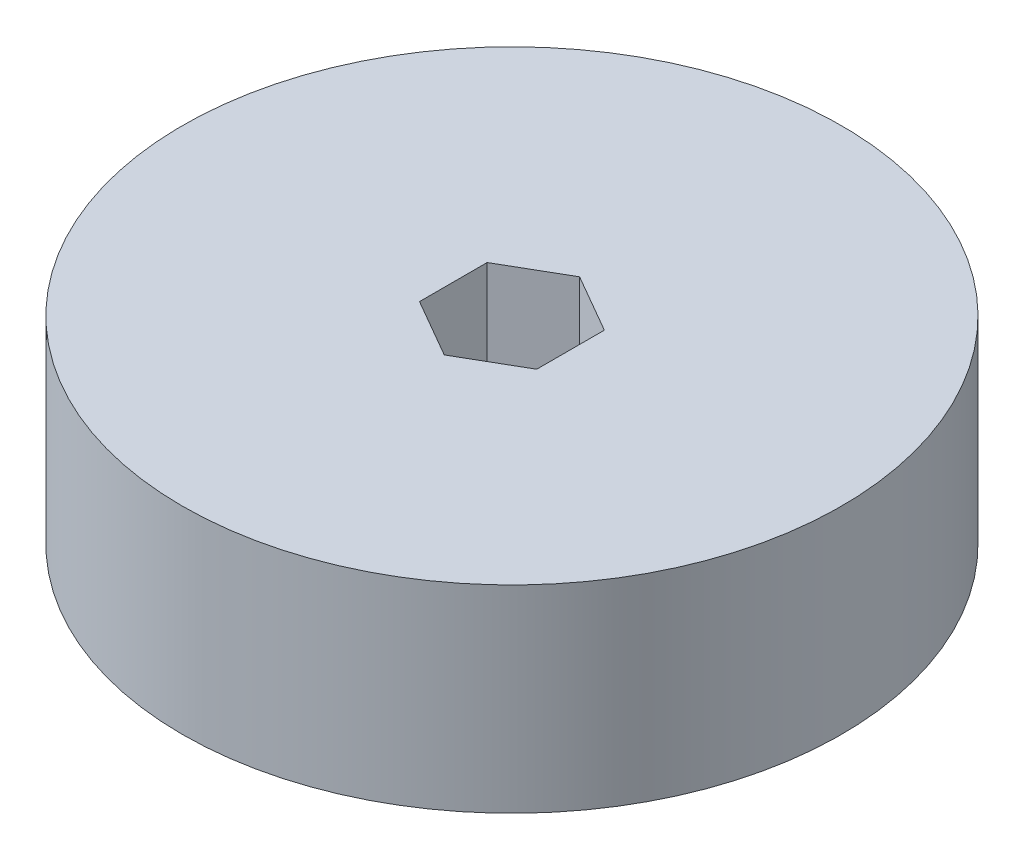
from build123d import *

# Parameters (mm, degrees)
SKETCH1_R           = 25
BOSS_EXTRUDE1_DEPTH = 15
CUT_EXTRUDE2_REACH  = 40.406
CUT_EXTRUDE3_DEPTH  = 5


with BuildPart() as part:
    # Sketch1 → Boss-Extrude1 (new body)
    with BuildSketch(Plane(origin=(0, 0, 0), x_dir=(1, 0, 0), z_dir=(0, 1, 0))):
        with Locations(Location((0, 0, 0), (0, 0, 270))):
            Circle(SKETCH1_R)
    extrude(amount=BOSS_EXTRUDE1_DEPTH)

    # Sketch7 → Cut-Extrude2 (cut, up to next)
    with BuildSketch(Plane(origin=(0, 15, 0), x_dir=(1, 0, 0), z_dir=(0, 1, 0)), mode=Mode.PRIVATE) as cut_extrude2_sk1:
        Polygon((0, 5.132643893), (-4.445, 2.566321947), (-4.445, -2.566321947), (0, -5.132643893), (4.445, -2.566321947), (4.445, 2.566321947), align=None)
    cut_extrude2_tool1 = extrude(cut_extrude2_sk1.sketch, amount=-CUT_EXTRUDE2_REACH, mode=Mode.PRIVATE) & part.part
    add(cut_extrude2_tool1.solids().sort_by_distance((0, 15, 0))[0], mode=Mode.SUBTRACT)

    # Sketch8 → Cut-Extrude3 (cut)
    with BuildSketch(Plane.XZ):
        with BuildLine():
            ThreePointArc((2.867832451, 6.276606431), (5.55485913, 5.311303559), (8.103473198, 4.024257195))
            ThreePointArc((8.103473198, 4.024257195), (12.790122891, 3.37163327), (17.445502266, 2.524257195))
            ThreePointArc((17.445502266, 2.524257195), (19.894779582, 1.820498395), (21, -0.475742805))
            ThreePointArc((21, -0.475742805), (19.894779582, -2.771984005), (17.445502266, -3.475742805))
            ThreePointArc((17.445502266, -3.475742805), (12.790122891, -4.32311888), (8.103473198, -4.975742805))
            ThreePointArc((8.103473198, -4.975742805), (5.55485913, -6.262789168), (2.867832451, -7.22809204))
            ThreePointArc((2.867832451, -7.22809204), (0, -7.852228414), (-2.867832451, -7.22809204))
            ThreePointArc((-2.867832451, -7.22809204), (-5.55485913, -6.262789168), (-8.103473198, -4.975742805))
            ThreePointArc((-8.103473198, -4.975742805), (-12.790122891, -4.32311888), (-17.445502266, -3.475742805))
            ThreePointArc((-17.445502266, -3.475742805), (-19.894779582, -2.771984005), (-21, -0.475742805))
            ThreePointArc((-21, -0.475742805), (-19.894779582, 1.820498395), (-17.445502266, 2.524257195))
            ThreePointArc((-17.445502266, 2.524257195), (-12.790122891, 3.37163327), (-8.103473198, 4.024257195))
            ThreePointArc((-8.103473198, 4.024257195), (-5.55485913, 5.311303559), (-2.867832451, 6.276606431))
            ThreePointArc((-2.867832451, 6.276606431), (0, 6.900742805), (2.867832451, 6.276606431))
        make_face()
    extrude(amount=-CUT_EXTRUDE3_DEPTH, mode=Mode.SUBTRACT)


solid = part.part
